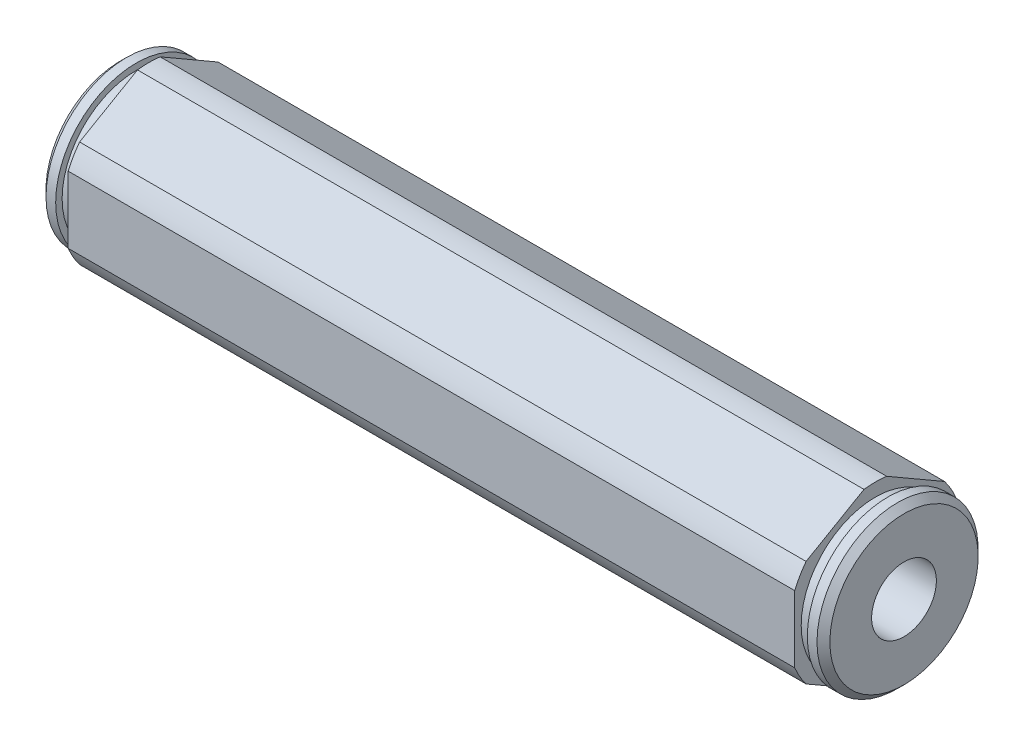
from build123d import *

# Parameters (mm, degrees)
CUT_EXTRUDE1_START = 2.2606
SKETCH2_OUTSIDE_W  = 30.324
SKETCH2_OUTSIDE_H  = 30.324
CUT_EXTRUDE1_DEPTH = 57.2516
SKETCH5_R          = 2.5527
CUT_EXTRUDE2_DEPTH = 61.7728
CHAMFER1_SIZE      = 0.508


with BuildPart() as part:
    # Sketch4 → Revolve1 (revolve)
    with BuildSketch(Plane(origin=(0, 0, 0), x_dir=(1, 0, 0), z_dir=(0, 1, 0)), mode=Mode.PRIVATE) as revolve1_sk:
        Polygon((1.27, 6.35), (1.27, 5.842), (2.2606, 5.842), (2.2606, 7.62), (59.5122, 7.62), (59.5122, 5.842), (60.5028, 5.842), (60.5028, 6.35), (61.7728, 6.35), (61.7728, 0), (0, 0), (0, 6.35), align=None)
    revolve(revolve1_sk.sketch.rotate(Axis((0, 0, 0), (1, 0, 0)), 180), axis=Axis((0, 0, 0), (1, 0, 0)))

    # Sketch2 outside → Cut-Extrude1 (cut)
    with BuildSketch(Plane(origin=(0, 0, 0), x_dir=(0, 0, -1), z_dir=(1, 0, 0)).offset(CUT_EXTRUDE1_START)):
        Rectangle(SKETCH2_OUTSIDE_W, SKETCH2_OUTSIDE_H)
        with BuildLine():
            Line((5.456960506, 4.181770802), (0.893039494, 6.816751826))
            ThreePointArc((0.893039494, 6.816751826), (0, 6.875), (-0.893039494, 6.816751826))
            Line((-0.893039494, 6.816751826), (-5.456960506, 4.181770802))
            ThreePointArc((-5.456960506, 4.181770802), (-5.953924651, 3.4375), (-6.35, 2.634981025))
            Line((-6.35, 2.634981025), (-6.35, -2.634981025))
            ThreePointArc((-6.35, -2.634981025), (-5.953924651, -3.4375), (-5.456960506, -4.181770802))
            Line((-5.456960506, -4.181770802), (-0.893039494, -6.816751826))
            ThreePointArc((-0.893039494, -6.816751826), (0, -6.875), (0.893039494, -6.816751826))
            Line((0.893039494, -6.816751826), (5.456960506, -4.181770802))
            ThreePointArc((5.456960506, -4.181770802), (5.953924651, -3.4375), (6.35, -2.634981025))
            Line((6.35, -2.634981025), (6.35, 2.634981025))
            ThreePointArc((6.35, 2.634981025), (5.953924651, 3.4375), (5.456960506, 4.181770802))
        make_face(mode=Mode.SUBTRACT)
    extrude(amount=CUT_EXTRUDE1_DEPTH, mode=Mode.SUBTRACT)

    # Sketch5 → Cut-Extrude2 (cut)
    with BuildSketch(Plane(origin=(61.7728, 0, 0), x_dir=(0, 0, -1), z_dir=(1, 0, 0))):
        Circle(SKETCH5_R)
    extrude(amount=-CUT_EXTRUDE2_DEPTH, mode=Mode.SUBTRACT)

    # Chamfer1
    chamfer1_edges = [part.edges().sort_by_distance(p)[0] for p in [
        (0, 0, -6.35),
        (61.7728, 0, -6.35),
    ]]
    chamfer(chamfer1_edges, length=CHAMFER1_SIZE)


solid = part.part
